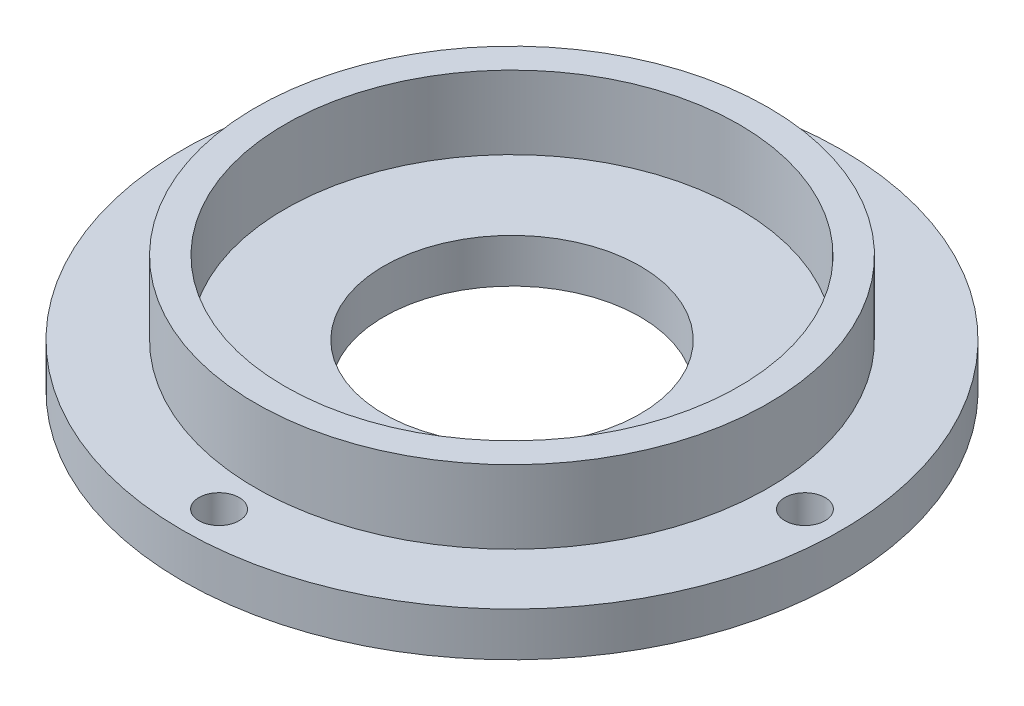
from build123d import *

# Parameters (mm, degrees)
FURO_COM_FOLGA_DE_M51_D = 5.5


with BuildPart() as part:
    # Esboço1 → Revolução1 (revolve)
    with BuildSketch(Plane.XY, mode=Mode.PRIVATE) as revolu_o1_sk:
        Polygon((17.5, 0), (17.5, 6), (31, 6), (31, 16), (35, 16), (35, 6), (45, 6), (45, 0), align=None)
    revolve(revolu_o1_sk.sketch.rotate(Axis((0, 0, 0), (0, 1, 0)), 90), axis=Axis((0, 0, 0), (0, 1, 0)))

    # Furo com folga de M51 (through all)
    with Locations(Plane(origin=(0, 6, 0), x_dir=(1, 0, 0), z_dir=(0, 1, 0))):
        with Locations((0, 40), (40, 0), (0, -40), (-40, 0)):
            Hole(FURO_COM_FOLGA_DE_M51_D / 2)


solid = part.part
